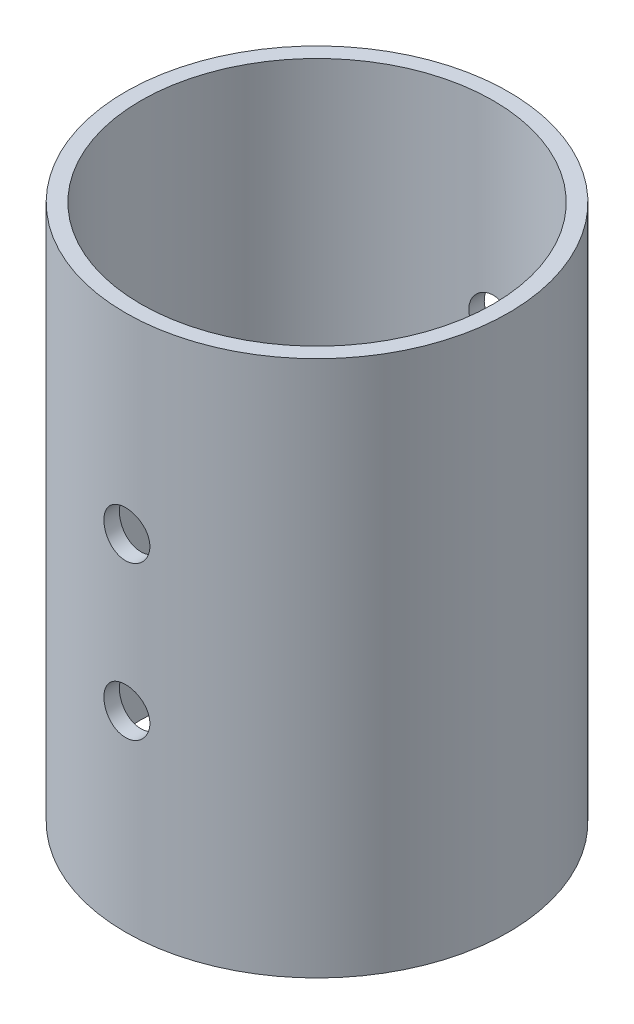
from build123d import *

# Parameters (mm, degrees)
SKETCH_1_R               = 25
SKETCH_1_R_2             = 23
EXTRUDE_1_DEPTH          = 70
CUT_EXTRUDE_1_DEPTH      = 79.421935707
CUT_EXTRUDE_1_DEPTH_BACK = 79.421935707
SKETCH_2_R               = 3


with BuildPart() as part:
    # 草图1 → 凸台-拉伸1 (new body)
    with BuildSketch(Plane(origin=(0, 0, 0), x_dir=(1, 0, 0), z_dir=(0, 1, 0))):
        with Locations(Location((0, 0, 0), (0, 0, 270))):
            Circle(SKETCH_1_R)
        with Locations(Location((0, 0, 0), (0, 0, 270))):
            Circle(SKETCH_1_R_2, mode=Mode.SUBTRACT)
    extrude(amount=EXTRUDE_1_DEPTH)

    # 草图2 → 切除-拉伸1 (cut, two sides: drawn at the far end of the back side and taken through both)
    with BuildSketch(Plane.XY.offset(-CUT_EXTRUDE_1_DEPTH_BACK)):
        with Locations((0, 45)):
            Circle(SKETCH_2_R)
        with Locations((0, 25)):
            Circle(SKETCH_2_R)
    extrude(amount=CUT_EXTRUDE_1_DEPTH + CUT_EXTRUDE_1_DEPTH_BACK, mode=Mode.SUBTRACT)


solid = part.part
